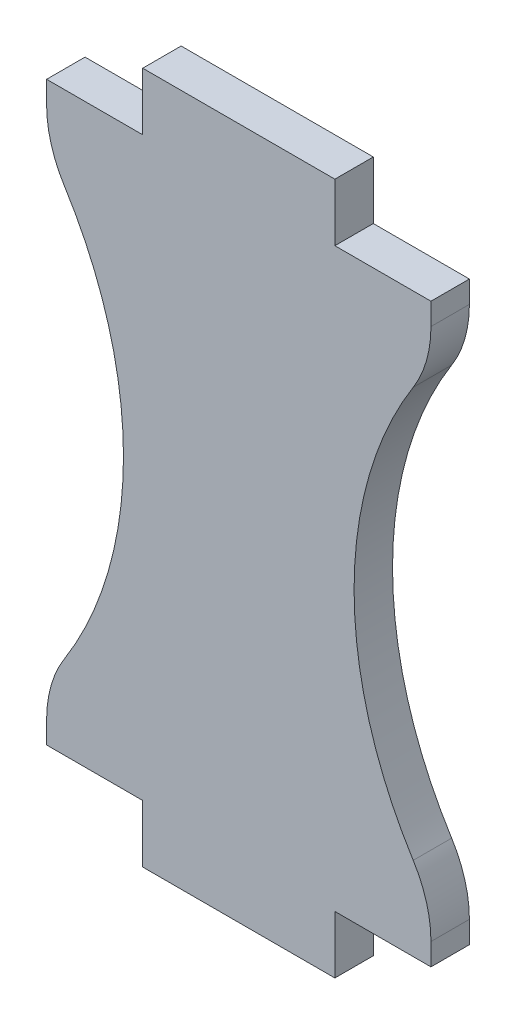
from build123d import *

# Parameters (mm, degrees)
EXTRUDE_1_DEPTH = 2


with BuildPart() as part:
    # Model → Бобышка-Вытянуть1 (new body)
    with BuildSketch(Plane.XY):
        with BuildLine():
            Line((-10, 33), (-5, 33))
            Line((-5, 33), (-5, 36))
            Line((-5, 36), (5, 36))
            Line((5, 36), (5, 33))
            Line((5, 33), (10, 33))
            Line((10, 33), (10, 31.856406461))
            ThreePointArc((10, 31.856406461), (9.764613537, 30.192305872), (9.076923077, 28.6587742))
            ThreePointArc((9.076923077, 28.6587742), (6, 18), (9.076923077, 7.3412258))
            ThreePointArc((9.076923077, 7.3412258), (9.764613537, 5.807694128), (10, 4.143593539))
            Line((10, 4.143593539), (10, 3))
            Line((10, 3), (5, 3))
            Line((5, 3), (5, 0))
            Line((5, 0), (-5, 0))
            Line((-5, 0), (-5, 3))
            Line((-5, 3), (-10, 3))
            Line((-10, 3), (-10, 4.143593539))
            ThreePointArc((-10, 4.143593539), (-9.764613537, 5.807694128), (-9.076923077, 7.3412258))
            ThreePointArc((-9.076923077, 7.3412258), (-6.000000001, 18), (-9.076923078, 28.6587742))
            ThreePointArc((-9.076923078, 28.6587742), (-9.764613538, 30.192305872), (-10, 31.856406461))
            Line((-10, 31.856406461), (-10, 33))
        make_face()
    extrude(amount=EXTRUDE_1_DEPTH)


solid = part.part
